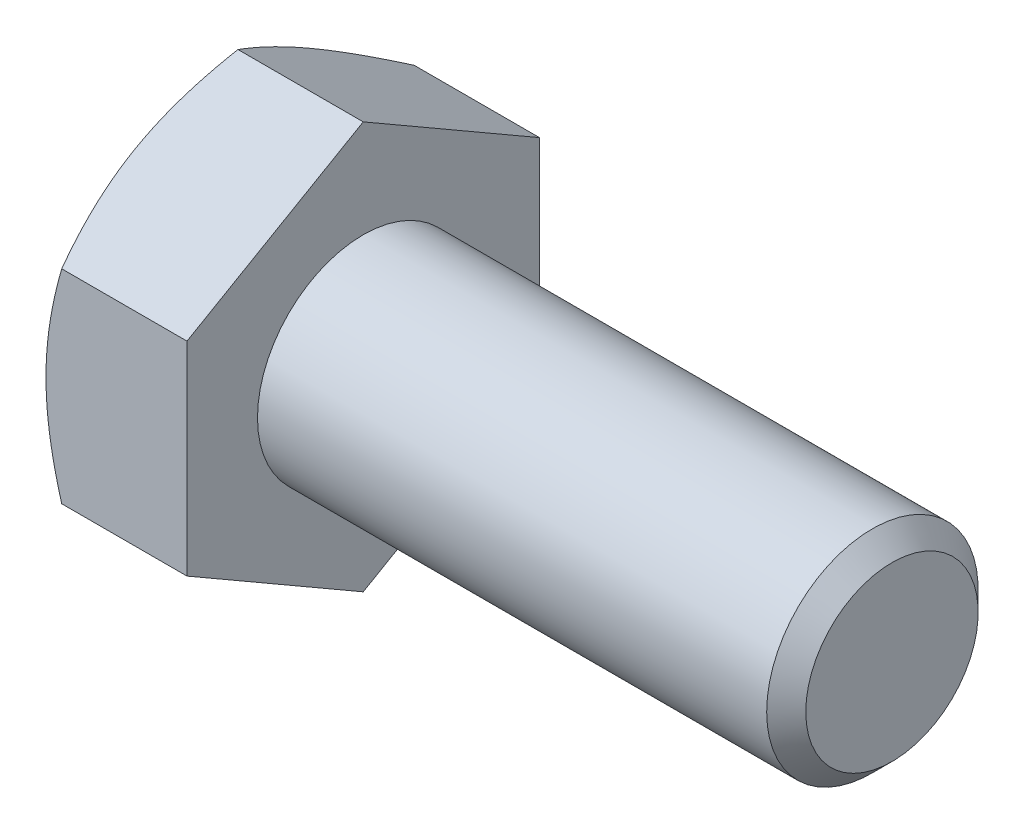
from build123d import *

# Parameters (mm, degrees)
BASEHEAD_DEPTH = 4


with BuildPart() as part:
    # Sketch1 → BaseHead (new body)
    with BuildSketch(Plane(origin=(0, 0, 0), x_dir=(0, 0, -1), z_dir=(1, 0, 0))):
        Polygon((5, 2.886751346), (5, -2.886751346), (0, -5.773502692), (-5, -2.886751346), (-5, 2.886751346), (0, 5.773502692), align=None)
    extrude(amount=BASEHEAD_DEPTH)

    # BodySke → BaseBody (revolve)
    with BuildSketch(Plane.XY, mode=Mode.PRIVATE) as basebody_sk:
        Polygon((0, 0), (19, 0), (19, 2.4455), (18.4455, 3), (0, 3), align=None)
    revolve(basebody_sk.sketch.rotate(Axis((0, 0, 0), (1, 0, 0)), 90), axis=Axis((0, 0, 0), (1, 0, 0)))

    # Sketch3 → HeadChamfer (revolve, cut)
    with BuildSketch(Plane.XY):
        Polygon((0, 5), (3.333333333, 10.773502692), (3.333333333, 15.773502692), (-10, 15.773502692), (-10, 5), align=None)
    revolve(axis=Axis((0, 0, 0), (1, 0, 0)), mode=Mode.SUBTRACT)


solid = part.part
